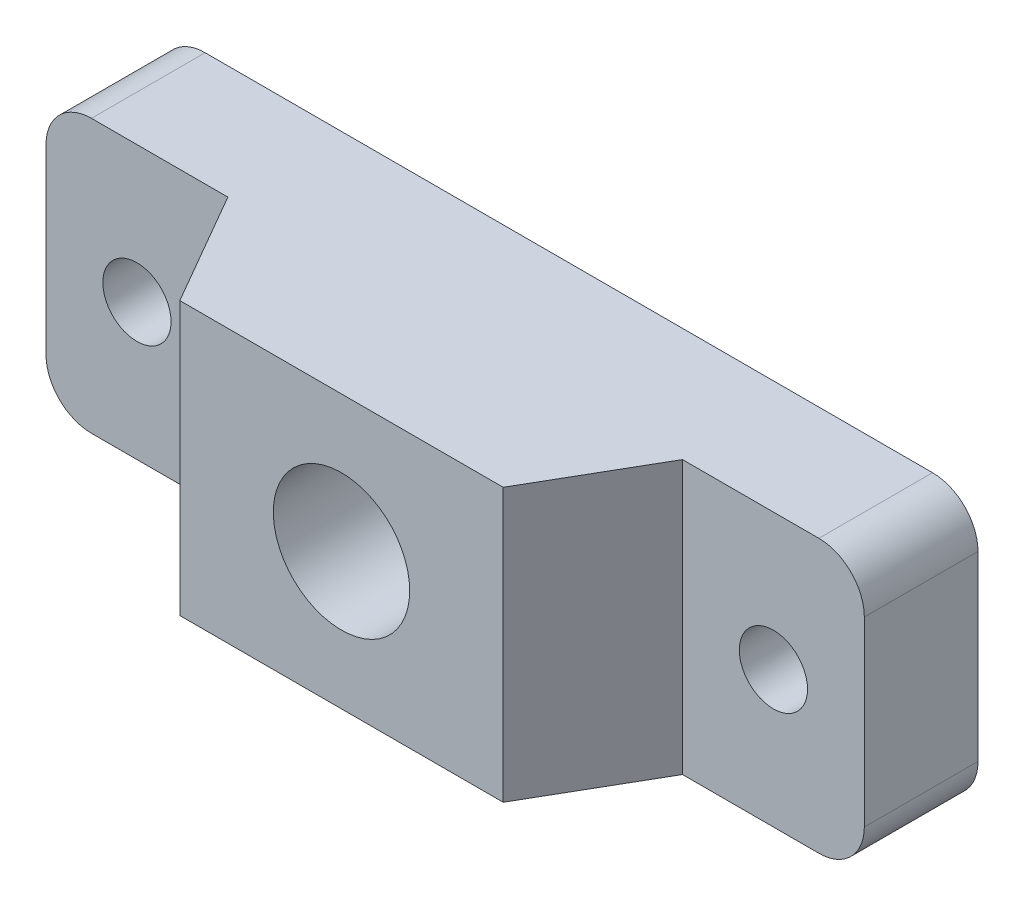
from build123d import *

# Parameters (mm, degrees)
ESQUISSE1_W             = 36
ESQUISSE1_H             = 12
ESQUISSE1_R             = 3
BOSS_EXTRU_1_DEPTH      = 10
ESQUISSE2_R             = 1.5
ENL_V_MAT_EXTRU_1_DEPTH = 22.44761059
ESQUISSE3_OUTSIDE_W     = 45.848
ESQUISSE3_OUTSIDE_H     = 19.848
ENL_V_MAT_EXTRU_2_DEPTH = 24.832750576
CONG_1_R                = 2


with BuildPart() as part:
    # Esquisse1 → Boss.-Extru.1 (new body)
    with BuildSketch(Plane.XY):
        Rectangle(ESQUISSE1_W, ESQUISSE1_H)
        Circle(ESQUISSE1_R, mode=Mode.SUBTRACT)
    extrude(amount=BOSS_EXTRU_1_DEPTH)

    # Esquisse2 → Enlèv. mat.-Extru.1 (cut, through all)
    with BuildSketch(Plane.XY.offset(10)):
        with Locations((-14, 0)):
            Circle(ESQUISSE2_R)
        with Locations((14, 0)):
            Circle(ESQUISSE2_R)
    extrude(amount=-ENL_V_MAT_EXTRU_1_DEPTH, mode=Mode.SUBTRACT)

    # Esquisse3 outside → Enlèv. mat.-Extru.2 (cut, through all)
    with BuildSketch(Plane.XZ.offset(6)):
        with Locations((0, 5)):
            Rectangle(ESQUISSE3_OUTSIDE_W, ESQUISSE3_OUTSIDE_H)
        Polygon((-18, 0), (-18, 5), (-10, 5), (-7.113248654, 10), (7.113248654, 10), (10, 5), (18, 5), (18, 0), align=None, mode=Mode.SUBTRACT)
    extrude(amount=-ENL_V_MAT_EXTRU_2_DEPTH, mode=Mode.SUBTRACT)

    # Congé1
    cong_1_edges = [part.edges().sort_by_distance(p)[0] for p in [
        (-18, 6, 2.5),
        (18, 6, 2.5),
        (18, -6, 2.5),
        (-18, -6, 2.5),
    ]]
    fillet(cong_1_edges, radius=CONG_1_R)


solid = part.part
